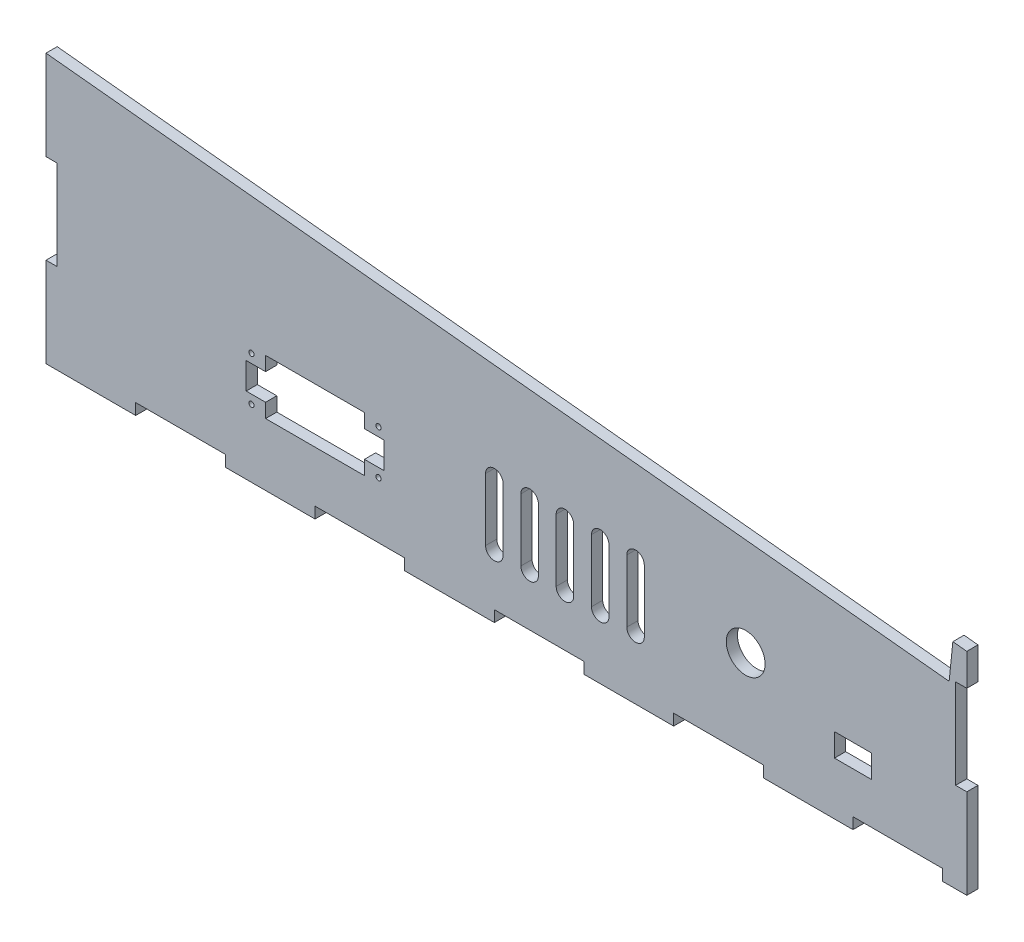
from build123d import *

# Parameters (mm, degrees)
SKETCH2_R           = 11
SKETCH2_R_2         = 1.5
SKETCH2_W           = 21
SKETCH2_H           = 13
BOSS_EXTRUDE1_DEPTH = 6.35


with BuildPart() as part:
    # Sketch2 → Boss-Extrude1 (new body)
    with BuildSketch(Plane.XY):
        Polygon((0, 152.4), (511.673882957, 100), (513.77689344, 120.535411062), (521.673882957, 119.726688428), (521.673882957, 101.6), (515.323882957, 101.6), (515.323882957, 50.8), (521.673882957, 50.8), (521.673882957, 0), (508, 0), (508, 6.35), (457.2, 6.35), (457.2, 0), (406.4, 0), (406.4, 6.35), (355.6, 6.35), (355.6, 0), (304.8, 0), (304.8, 6.35), (254, 6.35), (254, 0), (203.2, 0), (203.2, 6.35), (152.4, 6.35), (152.4, 0), (101.6, 0), (101.6, 6.35), (50.8, 6.35), (50.8, 0), (0, 0), (0, 50.8), (6.35, 50.8), (6.35, 101.6), (0, 101.6), align=None)
        with Locations((396.4, 56.35)):
            Circle(SKETCH2_R, mode=Mode.SUBTRACT)
        with Locations((116.4, 63.3)):
            Circle(SKETCH2_R_2, mode=Mode.SUBTRACT)
        with Locations((188.4, 63.3)):
            Circle(SKETCH2_R_2, mode=Mode.SUBTRACT)
        with Locations((188.4, 38.3)):
            Circle(SKETCH2_R_2, mode=Mode.SUBTRACT)
        with Locations((116.4, 38.3)):
            Circle(SKETCH2_R_2, mode=Mode.SUBTRACT)
        Polygon((180.4, 58.3), (191.4, 58.3), (191.4, 43.3), (180.4, 43.3), (180.4, 35.3), (124.4, 35.3), (124.4, 43.3), (113.4, 43.3), (113.4, 58.3), (124.4, 58.3), (124.4, 66.3), (180.4, 66.3), align=None, mode=Mode.SUBTRACT)
        with Locations((457.2, 36.35)):
            Rectangle(SKETCH2_W, SKETCH2_H, mode=Mode.SUBTRACT)
        with BuildLine():
            Line((249.0403247, 35.3), (249.0403247, 70.684208401))
            ThreePointArc((249.0403247, 70.684208401), (254, 75.643883701), (258.9596753, 70.684208401))
            Line((258.9596753, 70.684208401), (258.9596753, 35.3))
            ThreePointArc((258.9596753, 35.3), (254, 30.3403247), (249.0403247, 35.3))
        make_face(mode=Mode.SUBTRACT)
        with BuildLine():
            Line((269.0403247, 35.3), (269.0403247, 70.684208401))
            ThreePointArc((269.0403247, 70.684208401), (274, 75.643883701), (278.9596753, 70.684208401))
            Line((278.9596753, 70.684208401), (278.9596753, 35.3))
            ThreePointArc((278.9596753, 35.3), (274, 30.3403247), (269.0403247, 35.3))
        make_face(mode=Mode.SUBTRACT)
        with BuildLine():
            Line((289.0403247, 35.3), (289.0403247, 70.684208401))
            ThreePointArc((289.0403247, 70.684208401), (294, 75.643883701), (298.9596753, 70.684208401))
            Line((298.9596753, 70.684208401), (298.9596753, 35.3))
            ThreePointArc((298.9596753, 35.3), (294, 30.3403247), (289.0403247, 35.3))
        make_face(mode=Mode.SUBTRACT)
        with BuildLine():
            Line((309.0403247, 35.3), (309.0403247, 70.684208401))
            ThreePointArc((309.0403247, 70.684208401), (314, 75.643883701), (318.9596753, 70.684208401))
            Line((318.9596753, 70.684208401), (318.9596753, 35.3))
            ThreePointArc((318.9596753, 35.3), (314, 30.3403247), (309.0403247, 35.3))
        make_face(mode=Mode.SUBTRACT)
        with BuildLine():
            Line((329.0403247, 35.3), (329.0403247, 70.684208401))
            ThreePointArc((329.0403247, 70.684208401), (334, 75.643883701), (338.9596753, 70.684208401))
            Line((338.9596753, 70.684208401), (338.9596753, 35.3))
            ThreePointArc((338.9596753, 35.3), (334, 30.3403247), (329.0403247, 35.3))
        make_face(mode=Mode.SUBTRACT)
    extrude(amount=BOSS_EXTRUDE1_DEPTH)


solid = part.part
